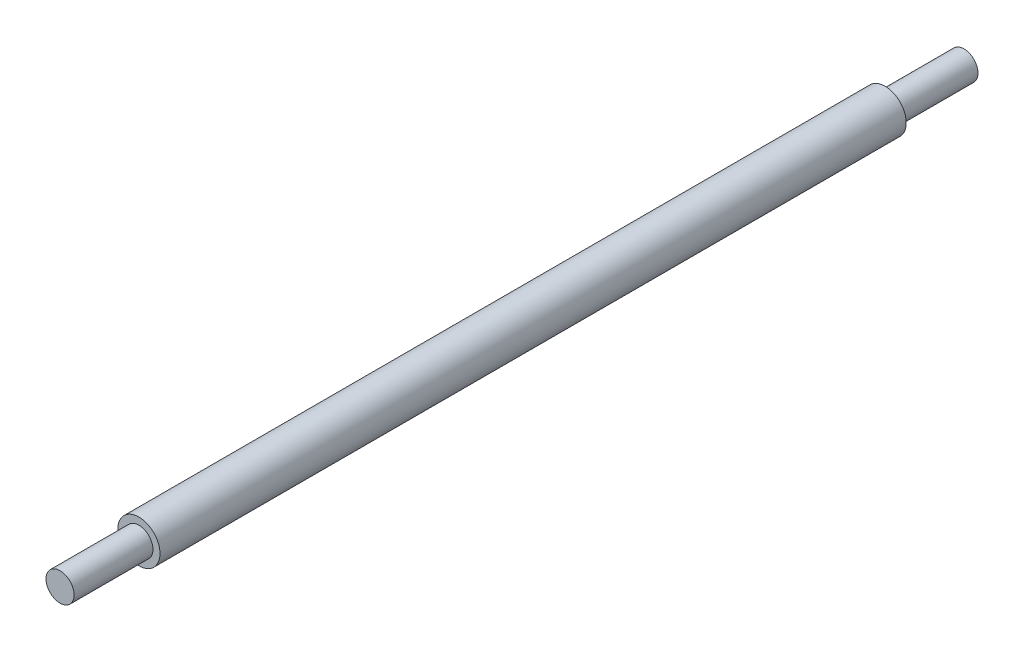
from build123d import *

# Parameters (mm, degrees)
SKETCH1_R           = 9.525
BOSS_EXTRUDE1_DEPTH = 336.55
SKETCH2_R           = 6.35
BOSS_EXTRUDE2_DEPTH = 35.56
BOSS_EXTRUDE3_START = 35.56
SKETCH3_R           = 6.35
BOSS_EXTRUDE3_DEPTH = 35.56


with BuildPart() as part:
    # Sketch1 → Boss-Extrude1 (new body)
    with BuildSketch(Plane.XY):
        Circle(SKETCH1_R)
    extrude(amount=BOSS_EXTRUDE1_DEPTH)

    # Sketch2 → Boss-Extrude2 (add)
    with BuildSketch(Plane.XY.offset(336.55)):
        Circle(SKETCH2_R)
    extrude(amount=BOSS_EXTRUDE2_DEPTH)

    # Sketch3 → Boss-Extrude3 (add)
    with BuildSketch(Plane(origin=(0, 0, 0), x_dir=(-1, 0, 0), z_dir=(0, 0, -1)).offset(BOSS_EXTRUDE3_START)):
        with Locations(Location((0, 0, 0), (0, 0, 180))):
            Circle(SKETCH3_R)
    extrude(amount=-BOSS_EXTRUDE3_DEPTH)


solid = part.part
